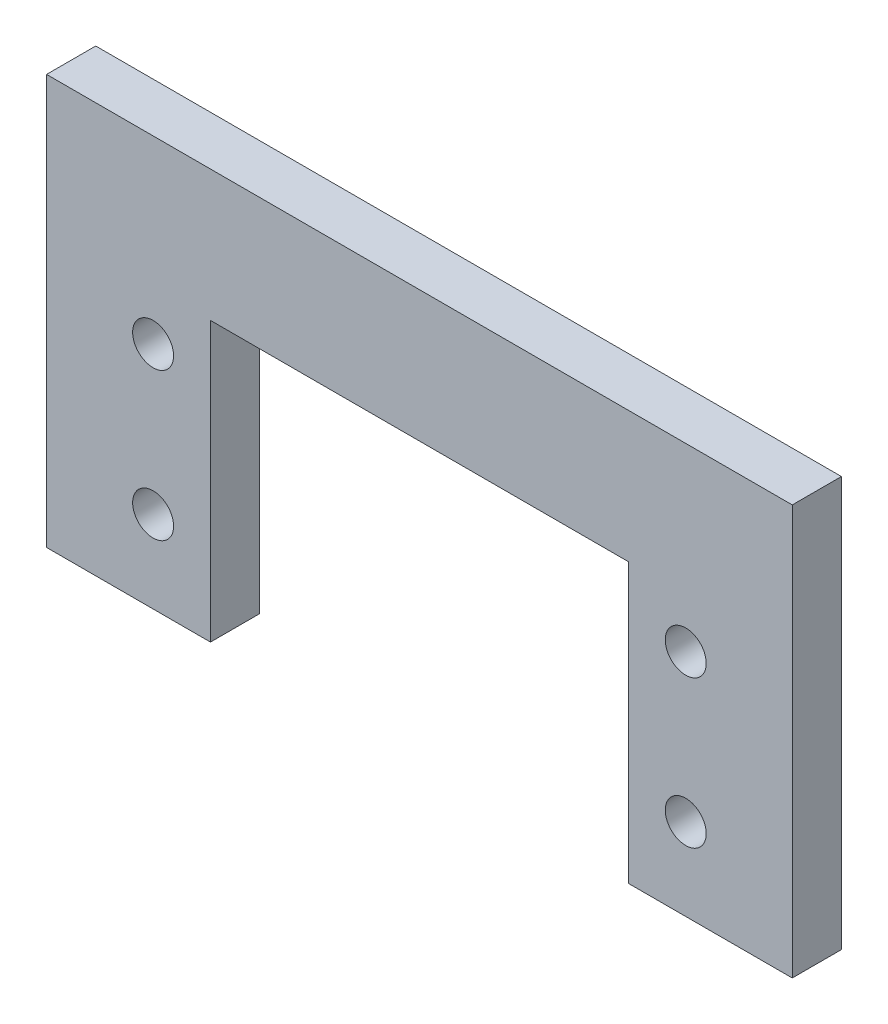
from build123d import *

# Parameters (mm, degrees)
BOSS_EXTRUDE1_DEPTH = 3
SKETCH1_3_R         = 1.25
CUT_EXTRUDE1_DEPTH  = 3


with BuildPart() as part:
    # Sketch1 → Boss-Extrude1 (new body)
    with BuildSketch(Plane.XY):
        Polygon((-22.75, 9), (-12.75, 9), (12.75, 9), (22.75, 9), (22.75, -16), (12.75, -16), (12.75, 1), (-12.75, 1), (-12.75, -16), (-22.75, -16), align=None)
    extrude(amount=BOSS_EXTRUDE1_DEPTH)

    # Sketch1<3> → Cut-Extrude1 (cut)
    with BuildSketch(Plane.XY):
        with Locations((-16.25, -2)):
            Circle(SKETCH1_3_R)
        with Locations((-16.25, -11)):
            Circle(SKETCH1_3_R)
        with Locations((16.25, -11)):
            Circle(SKETCH1_3_R)
        with Locations((16.25, -2)):
            Circle(SKETCH1_3_R)
    extrude(amount=CUT_EXTRUDE1_DEPTH, mode=Mode.SUBTRACT)


solid = part.part
